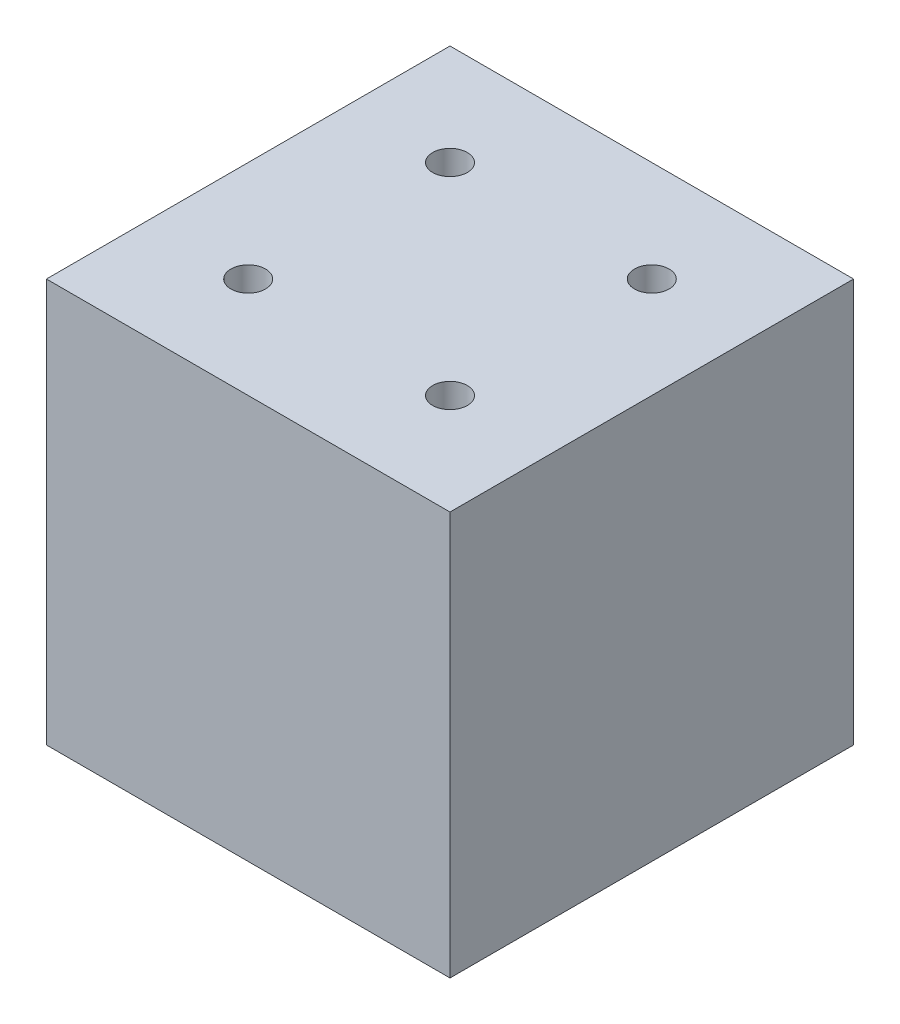
from build123d import *

# Parameters (mm, degrees)
SKETCH1_W           = 50.8
SKETCH1_H           = 50.8
BOSS_EXTRUDE1_DEPTH = 50.8
SKETCH2_R           = 2.1828125
CUT_EXTRUDE1_DEPTH  = 25.4


with BuildPart() as part:
    # Sketch1 → Boss-Extrude1 (new body)
    with BuildSketch(Plane(origin=(0, 0, 0), x_dir=(1, 0, 0), z_dir=(0, 1, 0))):
        Rectangle(SKETCH1_W, SKETCH1_H)
    extrude(amount=BOSS_EXTRUDE1_DEPTH)

    # Sketch2 → Cut-Extrude1 (cut)
    with BuildSketch(Plane(origin=(0, 50.8, 0), x_dir=(1, 0, 0), z_dir=(0, 1, 0))):
        with Locations(Location((-12.7, 12.7, 0), (0, 0, 270))):
            Circle(SKETCH2_R)
        with Locations(Location((-12.7, -12.7, 0), (0, 0, 270))):
            Circle(SKETCH2_R)
        with Locations(Location((12.7, -12.7, 0), (0, 0, 270))):
            Circle(SKETCH2_R)
        with Locations(Location((12.7, 12.7, 0), (0, 0, 270))):
            Circle(SKETCH2_R)
    extrude(amount=-CUT_EXTRUDE1_DEPTH, mode=Mode.SUBTRACT)


solid = part.part
